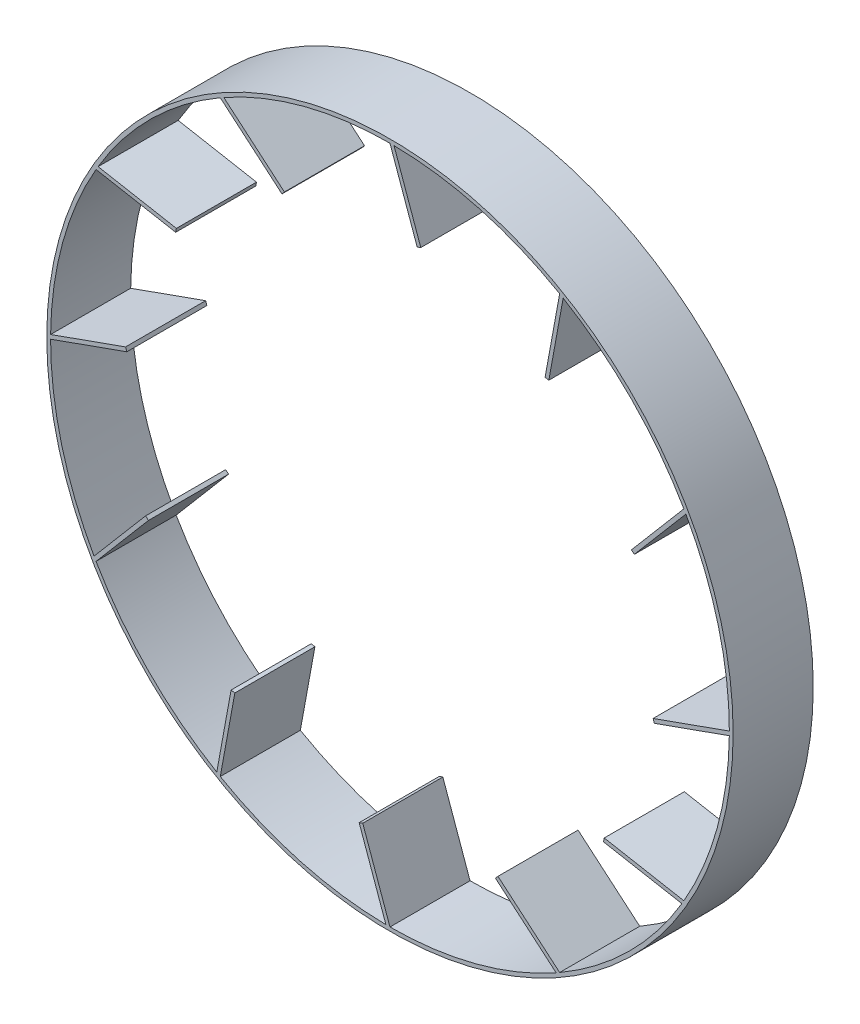
from build123d import *

# Parameters (mm, degrees)
SKETCH1_R           = 228.6
SKETCH1_R_2         = 226.06
BOSS_EXTRUDE1_DEPTH = 53.34
BOSS_EXTRUDE2_START = -53.34
BOSS_EXTRUDE2_DEPTH = 53.34


with BuildPart() as part:
    # Sketch1 → Boss-Extrude1 (new body)
    with BuildSketch(Plane.XY):
        Circle(SKETCH1_R)
        Circle(SKETCH1_R_2, mode=Mode.SUBTRACT)
    extrude(amount=BOSS_EXTRUDE1_DEPTH)

    # Sketch2 → Boss-Extrude2 (add)
    with BuildSketch(Plane.XY.offset(53.34).offset(BOSS_EXTRUDE2_START)):
        with BuildLine():
            Line((-226.06, 0), (-175.26, 18.123220102))
            Line((-175.26, 18.123220102), (-176.113474245, 20.515537328))
            Line((-176.113474245, 20.515537328), (-226.043844758, 2.702563026))
            ThreePointArc((-226.043844758, 2.702563026), (-226.055961153, 1.351305656), (-226.06, 0))
        make_face()
        with BuildLine():
            Line((-195.77370278, 113.03), (-142.718002216, 103.325169006))
            Line((-142.718002216, 103.325169006), (-142.260973981, 105.823713621))
            Line((-142.260973981, 105.823713621), (-194.408430417, 115.362410615))
            ThreePointArc((-194.408430417, 115.362410615), (-195.094552208, 114.198245603), (-195.77370278, 113.03))
        make_face()
        with BuildLine():
            Line((-113.03, 195.77370278), (-71.934830994, 160.841222318))
            Line((-71.934830994, 160.841222318), (-70.289760624, 162.776511309))
            Line((-70.289760624, 162.776511309), (-110.681434143, 197.110993443))
            ThreePointArc((-110.681434143, 197.110993443), (-111.857715551, 196.445857864), (-113.03, 195.77370278))
        make_face()
        with BuildLine():
            Line((0, 226.06), (18.123220102, 175.26))
            Line((18.123220102, 175.26), (20.515537328, 176.113474245))
            Line((20.515537328, 176.113474245), (2.702563026, 226.043844758))
            ThreePointArc((2.702563026, 226.043844758), (1.351305656, 226.055961153), (0, 226.06))
        make_face()
        with BuildLine():
            Line((113.03, 195.77370278), (103.325169006, 142.718002216))
            Line((103.325169006, 142.718002216), (105.823713621, 142.260973981))
            Line((105.823713621, 142.260973981), (115.362410615, 194.408430417))
            ThreePointArc((115.362410615, 194.408430417), (114.198245603, 195.094552208), (113.03, 195.77370278))
        make_face()
        with BuildLine():
            Line((195.77370278, 113.03), (160.841222318, 71.934830994))
            Line((160.841222318, 71.934830994), (162.776511309, 70.289760624))
            Line((162.776511309, 70.289760624), (197.110993443, 110.681434143))
            ThreePointArc((197.110993443, 110.681434143), (196.445857864, 111.857715551), (195.77370278, 113.03))
        make_face()
        with BuildLine():
            Line((226.06, 0), (175.26, -18.123220102))
            Line((175.26, -18.123220102), (176.113474245, -20.515537328))
            Line((176.113474245, -20.515537328), (226.043844758, -2.702563026))
            ThreePointArc((226.043844758, -2.702563026), (226.055961153, -1.351305656), (226.06, 0))
        make_face()
        with BuildLine():
            Line((195.77370278, -113.03), (142.718002216, -103.325169006))
            Line((142.718002216, -103.325169006), (142.260973981, -105.823713621))
            Line((142.260973981, -105.823713621), (194.408430417, -115.362410615))
            ThreePointArc((194.408430417, -115.362410615), (195.094552208, -114.198245603), (195.77370278, -113.03))
        make_face()
        with BuildLine():
            Line((113.03, -195.77370278), (71.934830994, -160.841222318))
            Line((71.934830994, -160.841222318), (70.289760624, -162.776511309))
            Line((70.289760624, -162.776511309), (110.681434143, -197.110993443))
            ThreePointArc((110.681434143, -197.110993443), (111.857715551, -196.445857864), (113.03, -195.77370278))
        make_face()
        with BuildLine():
            Line((0, -226.06), (-18.123220102, -175.26))
            Line((-18.123220102, -175.26), (-20.515537328, -176.113474245))
            Line((-20.515537328, -176.113474245), (-2.702563026, -226.043844758))
            ThreePointArc((-2.702563026, -226.043844758), (-1.351305656, -226.055961153), (0, -226.06))
        make_face()
        with BuildLine():
            Line((-113.03, -195.77370278), (-103.325169006, -142.718002216))
            Line((-103.325169006, -142.718002216), (-105.823713621, -142.260973981))
            Line((-105.823713621, -142.260973981), (-115.362410615, -194.408430417))
            ThreePointArc((-115.362410615, -194.408430417), (-114.198245603, -195.094552208), (-113.03, -195.77370278))
        make_face()
        with BuildLine():
            Line((-195.77370278, -113.03), (-160.841222318, -71.934830994))
            Line((-160.841222318, -71.934830994), (-162.776511309, -70.289760624))
            Line((-162.776511309, -70.289760624), (-197.110993443, -110.681434143))
            ThreePointArc((-197.110993443, -110.681434143), (-196.445857864, -111.857715551), (-195.77370278, -113.03))
        make_face()
    extrude(amount=BOSS_EXTRUDE2_DEPTH)


solid = part.part
